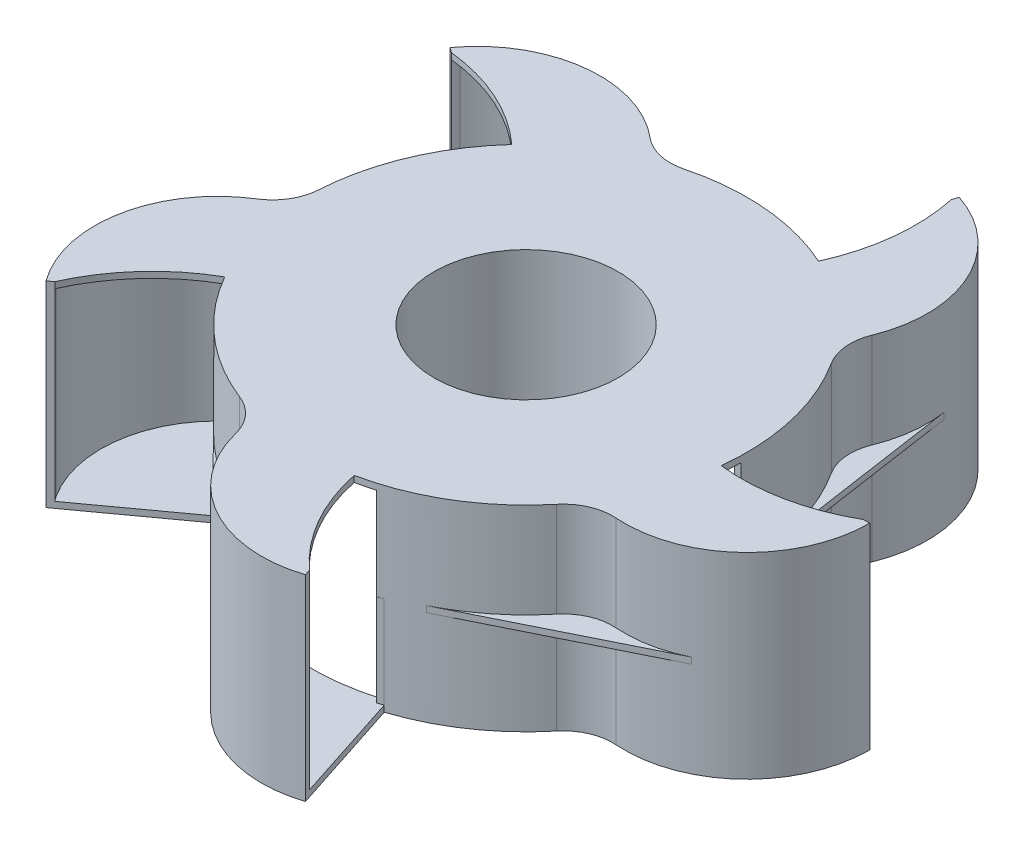
from build123d import *
from build123d.topology import SkipClean

# Parameters (mm, degrees)
BOSS_EXTRUDE1_DEPTH     = 50.8
CUT_EXTRUDE1_DEPTH      = 47.625
CUT_EXTRUDE1_DEPTH_BACK = 47.625
SKETCH3_R               = 50.8
SKETCH4_R               = 47.625
CUT_EXTRUDE2_DEPTH      = 268.563494731
CUT_EXTRUDE3_REACH      = 269.563
SKETCH5_R               = 111.125
SKETCH5_R_2             = 50.8
CUT_EXTRUDE4_START      = -50.8
CUT_EXTRUDE4_DEPTH      = 50.8
BOSS_EXTRUDE2_DEPTH     = 1.5875


with BuildPart() as part:
    # Sketch1 → Boss-Extrude1 (new, symmetric)
    with BuildSketch(Plane(origin=(0, 0, 0), x_dir=(1, 0, 0), z_dir=(0, 1, 0))):
        with BuildLine():
            Line((177.8, 0), (114.3, 0))
            ThreePointArc((114.3, 0), (109.705904095, 32.079660325), (96.29292027, 61.580544866))
            ThreePointArc((96.29292027, 61.580544866), (92.397970552, 72.940221568), (94.156859985, 84.819581654))
            ThreePointArc((94.156859985, 84.819581654), (92.893659257, 135.493774605), (54.9432216, 169.097848597))
            Line((54.9432216, 169.097848597), (35.320642457, 108.705759813))
            ThreePointArc((35.320642457, 108.705759813), (3.391418756, 114.24967518), (-28.81042967, 110.609444182))
            ThreePointArc((-28.81042967, 110.609444182), (-40.817729876, 110.415460024), (-51.57214597, 115.75918743))
            ThreePointArc((-51.57214597, 115.75918743), (-100.156517875, 130.216998944), (-143.8432216, 104.508217858))
            Line((-143.8432216, 104.508217858), (-92.470642457, 67.183854337))
            ThreePointArc((-92.470642457, 67.183854337), (-107.609892034, 38.53052214), (-114.098745036, 6.779851116))
            ThreePointArc((-114.098745036, 6.779851116), (-117.624714959, -4.69971439), (-126.030199067, -13.276469313))
            ThreePointArc((-126.030199067, -13.276469313), (-154.793791499, -55.015243345), (-143.8432216, -104.508217858))
            Line((-143.8432216, -104.508217858), (-92.470642457, -67.183854337))
            ThreePointArc((-92.470642457, -67.183854337), (-69.897989559, -90.436502894), (-41.706472836, -106.419265754))
            ThreePointArc((-41.706472836, -106.419265754), (-31.878341885, -113.320043254), (-26.318800663, -123.964496716))
            ThreePointArc((-26.318800663, -123.964496716), (4.488693481, -164.21828923), (54.9432216, -169.097848597))
            Line((54.9432216, -169.097848597), (35.320642457, -108.705759813))
            ThreePointArc((35.320642457, -108.705759813), (64.410558742, -94.423354752), (88.322727273, -72.550574409))
            ThreePointArc((88.322727273, -72.550574409), (97.922816169, -65.335923948), (109.764285714, -63.337803056))
            ThreePointArc((109.764285714, -63.337803056), (157.567956636, -46.477240974), (177.8, 0))
        make_face()
    extrude(amount=BOSS_EXTRUDE1_DEPTH, both=True)

    # Sketch3 → Cut-Extrude1 (cut, two sides: drawn at the far end of the back side and taken through both)
    with BuildSketch(Plane(origin=(0, 0, 0), x_dir=(1, 0, 0), z_dir=(0, 1, 0)).offset(-CUT_EXTRUDE1_DEPTH_BACK)):
        with BuildLine():
            Line((174.541389426, 0), (114.3, 0))
            Line((114.3, 0), (114.3, -3.175))
            Line((114.3, -3.175), (111.079633597, -3.175))
            ThreePointArc((111.079633597, -3.175), (107.093227889, 29.661526685), (93.618116929, 59.869974175))
            ThreePointArc((93.618116929, 59.869974175), (89.236298496, 72.649610465), (91.215049109, 86.013890562))
            ThreePointArc((91.215049109, 86.013890562), (90.665986049, 132.705729973), (56.955859994, 165.01759682))
            Line((56.955859994, 165.01759682), (53.936255555, 165.998725777))
            Line((53.936255555, 165.998725777), (35.320642457, 108.705759813))
            Line((35.320642457, 108.705759813), (38.340246896, 107.724630855))
            Line((38.340246896, 107.724630855), (37.34509895, 104.661880403))
            ThreePointArc((37.34509895, 104.661880403), (4.883839164, 111.01762806), (-28.010139957, 107.536959621))
            ThreePointArc((-28.010139957, 107.536959621), (-41.518352689, 107.318727443), (-53.617070794, 113.330420775))
            ThreePointArc((-53.617070794, 113.330420775), (-98.19331874, 127.236802651), (-139.340732092, 105.161483577))
            Line((-139.340732092, 105.161483577), (-141.206950268, 102.592854619))
            Line((-141.206950268, 102.592854619), (-92.470642457, 67.183854337))
            Line((-92.470642457, 67.183854337), (-90.604424281, 69.752483294))
            Line((-90.604424281, 69.752483294), (-87.999093133, 67.859599415))
            ThreePointArc((-87.999093133, 67.859599415), (-104.074849291, 38.951140807), (-110.929335452, 6.591521918))
            ThreePointArc((-110.929335452, 6.591521918), (-114.896051615, -6.322989276), (-124.352221237, -15.971838564))
            ThreePointArc((-124.352221237, -15.971838564), (-151.352794498, -54.069061315), (-143.073168444, -100.024225662))
            Line((-143.073168444, -100.024225662), (-141.206950268, -102.592854619))
            Line((-141.206950268, -102.592854619), (-92.470642457, -67.183854337))
            Line((-92.470642457, -67.183854337), (-94.336860633, -64.61522538))
            Line((-94.336860633, -64.61522538), (-91.731529485, -62.722341501))
            ThreePointArc((-91.731529485, -62.722341501), (-69.205633399, -86.944499141), (-40.547959702, -103.463175038))
            ThreePointArc((-40.547959702, -103.463175038), (-29.491312382, -111.226549727), (-23.236828507, -123.20155987))
            ThreePointArc((-23.236828507, -123.20155987), (4.652147447, -160.653320283), (50.916651115, -166.979854734))
            Line((50.916651115, -166.979854734), (53.936255555, -165.998725777))
            Line((53.936255555, -165.998725777), (35.320642457, -108.705759813))
            Line((35.320642457, -108.705759813), (32.301038018, -109.68688877))
            Line((32.301038018, -109.68688877), (31.305890071, -106.624138317))
            ThreePointArc((31.305890071, -106.624138317), (61.303415637, -92.685796411), (85.869318182, -70.535280676))
            ThreePointArc((85.869318182, -70.535280676), (96.66941819, -62.418798906), (109.991071429, -60.170912903))
            ThreePointArc((109.991071429, -60.170912903), (154.227979741, -45.220151026), (174.541389426, -3.175))
            Line((174.541389426, -3.175), (174.541389426, 0))
        make_face()
        with Locations(Location((0, 0, 0), (0, 0, 270))):
            Circle(SKETCH3_R, mode=Mode.SUBTRACT)
    extrude(amount=CUT_EXTRUDE1_DEPTH + CUT_EXTRUDE1_DEPTH_BACK, mode=Mode.SUBTRACT)

    # Sketch4 → Cut-Extrude2 (cut, through all)
    with BuildSketch(Plane(origin=(0, 50.8, 0), x_dir=(1, 0, 0), z_dir=(0, 1, 0))):
        with Locations(Location((0, 0, 0), (0, 0, 270))):
            Circle(SKETCH4_R)
    extrude(amount=-CUT_EXTRUDE2_DEPTH, mode=Mode.SUBTRACT)

    # Sketch5 → Cut-Extrude3 (cut, up to next)
    with BuildSketch(Plane(origin=(0, -50.8, 0), x_dir=(-1, 0, 0), z_dir=(0, -1, 0)), mode=Mode.PRIVATE) as cut_extrude3_sk1:
        with Locations(Location((0, 0, 0), (0, 0, 253.637245078))):
            Circle(SKETCH5_R)
        with Locations(Location((0, 0, 0), (0, 0, 270))):
            Circle(SKETCH5_R_2, mode=Mode.SUBTRACT)
    cut_extrude3_tool1 = extrude(cut_extrude3_sk1.sketch, amount=-CUT_EXTRUDE3_REACH, mode=Mode.PRIVATE) & part.part
    add(cut_extrude3_tool1.solids().sort_by_distance((-30.420426, -50.8, -103.608352))[0], mode=Mode.SUBTRACT)

    # Sketch6 → Cut-Extrude4 (cut)
    with BuildSketch(Plane(origin=(0, 50.8, 0), x_dir=(1, 0, 0), z_dir=(0, 1, 0)).offset(CUT_EXTRUDE4_START)):
        with BuildLine():
            Line((114.3, 0), (174.541389426, 0))
            ThreePointArc((174.541389426, 0), (145.079056306, -11.200128313), (113.594444444, -12.680386089))
            ThreePointArc((113.594444444, -12.680386089), (114.123474798, -6.35), (114.3, 0))
        make_face()
        with BuildLine():
            Line((35.320642457, 108.705759813), (53.936255555, 165.998725777))
            ThreePointArc((53.936255555, 165.998725777), (55.483848942, 134.51735189), (47.162377619, 104.116281807))
            ThreePointArc((47.162377619, 104.116281807), (41.305302048, 106.575616455), (35.320642457, 108.705759813))
        make_face()
        with BuildLine():
            Line((35.320642457, -108.705759813), (53.936255555, -165.998725777))
            ThreePointArc((53.936255555, -165.998725777), (34.179938911, -141.439411865), (23.042849981, -111.9531914))
            ThreePointArc((23.042849981, -111.9531914), (29.226884291, -110.500132283), (35.320642457, -108.705759813))
        make_face()
        with BuildLine():
            Line((-92.470642457, -67.183854337), (-141.206950268, -102.592854619))
            ThreePointArc((-141.206950268, -102.592854619), (-123.954692325, -76.214235568), (-99.353179958, -56.510491346))
            ThreePointArc((-99.353179958, -56.510491346), (-96.060266921, -61.942837512), (-92.470642457, -67.183854337))
        make_face()
        with BuildLine():
            Line((-92.470642457, 67.183854337), (-141.206950268, 102.592854619))
            ThreePointArc((-141.206950268, 102.592854619), (-110.788151833, 94.336423858), (-84.446492086, 77.027787028))
            ThreePointArc((-84.446492086, 77.027787028), (-88.595394217, 72.217353341), (-92.470642457, 67.183854337))
        make_face()
    extrude(amount=CUT_EXTRUDE4_DEPTH, mode=Mode.SUBTRACT)

    # Sketch7 → Boss-Extrude2 (add, symmetric)
    with BuildSketch(Plane(origin=(0, 0, 0), x_dir=(1, 0, 0), z_dir=(0, 1, 0))):
        with BuildLine():
            Line((-10.057831895, -153.124720465), (-81.681253834, -79.954129175))
            ThreePointArc((-81.681253834, -79.954129175), (-63.097017653, -95.306119233), (-41.706472836, -106.419265754))
            ThreePointArc((-41.706472836, -106.419265754), (-31.878341885, -113.320043254), (-26.318800663, -123.964496716))
            ThreePointArc((-26.318800663, -123.964496716), (-20.139147727, -139.63247436), (-10.057831895, -153.124720465))
        make_face()
        with BuildLine():
            Line((-148.738304187, -37.752574319), (-101.281791113, 52.976304032))
            ThreePointArc((-101.281791113, 52.976304032), (-110.139556489, 30.557619287), (-114.098745036, 6.779851116))
            ThreePointArc((-114.098745036, 6.779851116), (-117.624714959, -4.69971439), (-126.030199067, -13.276469313))
            ThreePointArc((-126.030199067, -13.276469313), (-139.021713527, -23.995339865), (-148.738304187, -37.752574319))
        make_face()
        with BuildLine():
            Line((-81.867495521, 129.792346373), (19.085664485, 112.695285665))
            ThreePointArc((19.085664485, 112.695285665), (-4.972971763, 114.191766568), (-28.81042967, 110.609444182))
            ThreePointArc((-28.81042967, 110.609444182), (-40.817729876, 110.415460024), (-51.57214597, 115.75918743))
            ThreePointArc((-51.57214597, 115.75918743), (-65.780996406, 124.802538752), (-81.867495521, 129.792346373))
        make_face()
        with BuildLine():
            Line((98.141409381, 117.968655857), (113.077380462, 16.673212881))
            ThreePointArc((113.077380462, 16.673212881), (107.066090914, 40.016773687), (96.29292027, 61.580544866))
            ThreePointArc((96.29292027, 61.580544866), (92.397970552, 72.940221568), (94.156859985, 84.819581654))
            ThreePointArc((94.156859985, 84.819581654), (98.366821934, 101.127550696), (98.141409381, 117.968655857))
        make_face()
        with BuildLine():
            Line((142.522222222, -56.883707446), (50.8, -102.390673403))
            ThreePointArc((50.8, -102.390673403), (71.14345499, -89.460040309), (88.322727273, -72.550574409))
            ThreePointArc((88.322727273, -72.550574409), (97.922816169, -65.335923948), (109.764285714, -63.337803056))
            ThreePointArc((109.764285714, -63.337803056), (126.575035727, -62.302275223), (142.522222222, -56.883707446))
        make_face()
    extrude(amount=BOSS_EXTRUDE2_DEPTH, both=True)


solid = part.part
